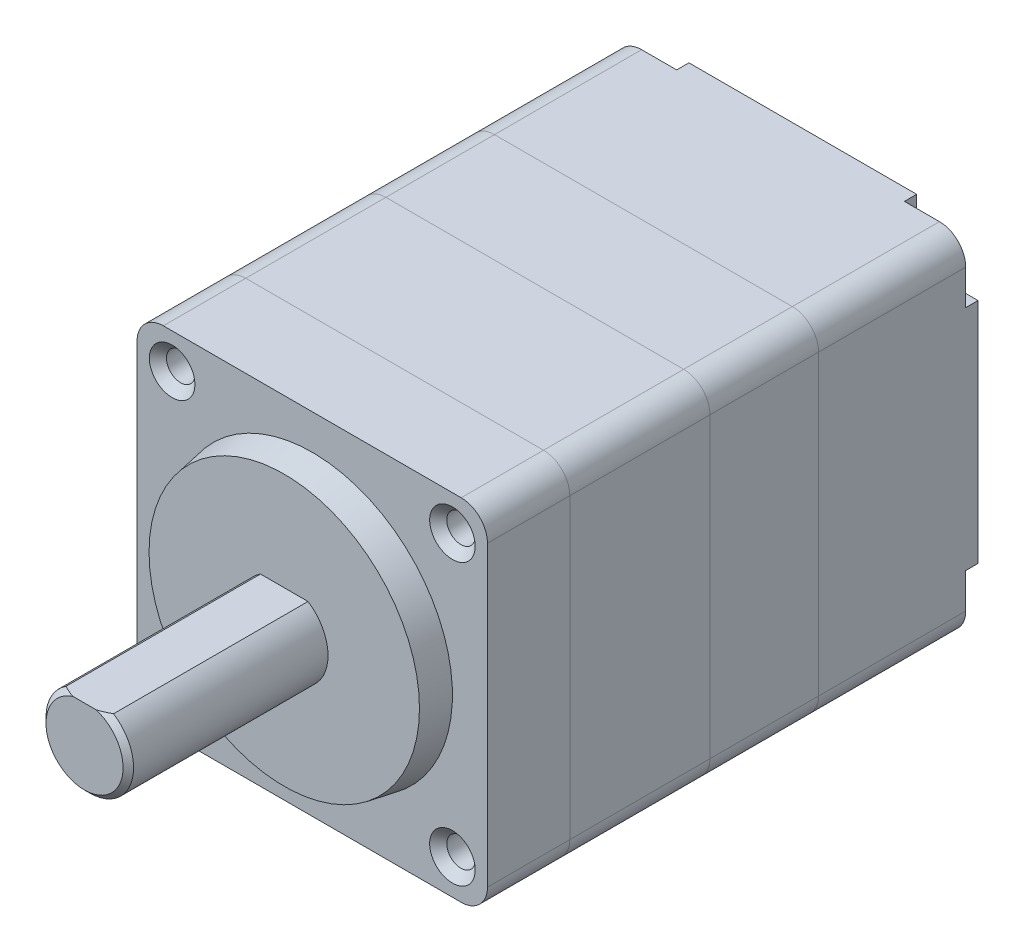
from build123d import *

# Parameters (mm, degrees)
SKETCH_1_W          = 20
SKETCH_1_H          = 20
EXTRUDE_1_DEPTH     = 9.1
CUT_EXTRUDE_1_REACH = 18.817
SKETCH_2_R          = 1
SKETCH_3_W          = 3.5
SKETCH_3_H          = 3.5
CUT_EXTRUDE_2_DEPTH = 0.7
FILLET_1_R          = 1.5
SKETCH_4_W          = 20
SKETCH_4_H          = 20
EXTRUDE_2_DEPTH     = 6.2
SKETCH_5_W          = 20
SKETCH_5_H          = 20
EXTRUDE_3_DEPTH     = 8
CUT_EXTRUDE_START   = -8
SKETCH_6_R          = 1
CUT_EXTRUDE_3_DEPTH = 8
SKETCH_7_W          = 20
SKETCH_7_H          = 20
EXTRUDE_4_DEPTH     = 4.7
SKETCH_8_R          = 0.8115
CUT_EXTRUDE_4_DEPTH = 4.7
FILLET_2_R          = 1.5
FILLET_3_R          = 1.5
FILLET_4_R          = 1.5
FILLET_5_R          = 1.5
CUT_EXTRUDE_5_DEPTH = 1.6
EXTRUDE_5_DEPTH     = 13
CHAMFER_1_SIZE      = 0.3
CHAMFER_2_SIZE      = 0.4885


with BuildPart() as part:
    # 草图1 → 凸台-拉伸1 (new body)
    with BuildSketch(Plane.XY):
        Rectangle(SKETCH_1_W, SKETCH_1_H)
    extrude(amount=EXTRUDE_1_DEPTH)

    # 草图2 → 切除-拉伸1 (cut, up to next)
    with BuildSketch(Plane(origin=(0, 0, 0), x_dir=(-1, 0, 0), z_dir=(0, 0, -1)), mode=Mode.PRIVATE) as cut_extrude_1_sk1:
        with Locations((-8, 8)):
            Circle(SKETCH_2_R)
    cut_extrude_1_tool1 = extrude(cut_extrude_1_sk1.sketch, amount=-CUT_EXTRUDE_1_REACH, mode=Mode.PRIVATE) & part.part
    # 草图2 → 切除-拉伸1 (cut, up to next)
    with BuildSketch(Plane(origin=(0, 0, 0), x_dir=(-1, 0, 0), z_dir=(0, 0, -1)), mode=Mode.PRIVATE) as cut_extrude_1_sk2:
        with Locations((8, 8)):
            Circle(SKETCH_2_R)
    cut_extrude_1_tool2 = extrude(cut_extrude_1_sk2.sketch, amount=-CUT_EXTRUDE_1_REACH, mode=Mode.PRIVATE) & part.part
    # 草图2 → 切除-拉伸1 (cut, up to next)
    with BuildSketch(Plane(origin=(0, 0, 0), x_dir=(-1, 0, 0), z_dir=(0, 0, -1)), mode=Mode.PRIVATE) as cut_extrude_1_sk3:
        with Locations((8, -8)):
            Circle(SKETCH_2_R)
    cut_extrude_1_tool3 = extrude(cut_extrude_1_sk3.sketch, amount=-CUT_EXTRUDE_1_REACH, mode=Mode.PRIVATE) & part.part
    # 草图2 → 切除-拉伸1 (cut, up to next)
    with BuildSketch(Plane(origin=(0, 0, 0), x_dir=(-1, 0, 0), z_dir=(0, 0, -1)), mode=Mode.PRIVATE) as cut_extrude_1_sk4:
        with Locations((-8, -8)):
            Circle(SKETCH_2_R)
    cut_extrude_1_tool4 = extrude(cut_extrude_1_sk4.sketch, amount=-CUT_EXTRUDE_1_REACH, mode=Mode.PRIVATE) & part.part
    add(cut_extrude_1_tool1.solids().sort_by_distance((8, 8, 0))[0], mode=Mode.SUBTRACT)
    add(cut_extrude_1_tool2.solids().sort_by_distance((-8, 8, 0))[0], mode=Mode.SUBTRACT)
    add(cut_extrude_1_tool3.solids().sort_by_distance((-8, -8, 0))[0], mode=Mode.SUBTRACT)
    add(cut_extrude_1_tool4.solids().sort_by_distance((8, -8, 0))[0], mode=Mode.SUBTRACT)

    # 草图3 → 切除-拉伸2 (cut)
    with BuildSketch(Plane(origin=(0, 0, 0), x_dir=(-1, 0, 0), z_dir=(0, 0, -1))):
        with Locations((-8.25, 8.25)):
            Rectangle(SKETCH_3_W, SKETCH_3_H)
        with Locations((8.25, 8.25)):
            Rectangle(SKETCH_3_W, SKETCH_3_H)
        with Locations((8.25, -8.25)):
            Rectangle(SKETCH_3_W, SKETCH_3_H)
        with Locations((-8.25, -8.25)):
            Rectangle(SKETCH_3_W, SKETCH_3_H)
    extrude(amount=-CUT_EXTRUDE_2_DEPTH, mode=Mode.SUBTRACT)

    # 圆角1
    fillet_1_edges = [part.edges().sort_by_distance(p)[0] for p in [
        (6.5, -6.5, 0.35),
        (-6.5, -6.5, 0.35),
        (-6.5, 6.5, 0.35),
        (6.5, 6.5, 0.35),
    ]]
    fillet(fillet_1_edges, radius=FILLET_1_R)

    # 圆角5
    fillet_5_edges = [part.edges().sort_by_distance(p)[0] for p in [
        (10, -10, 4.9),
        (-10, -10, 4.9),
        (-10, 10, 4.9),
        (10, 10, 4.9),
    ]]
    fillet(fillet_5_edges, radius=FILLET_5_R)


with BuildPart() as body_2:
    # 草图4 → 凸台-拉伸2 (new body)
    with BuildSketch(Plane.XY.offset(9.1)):
        Rectangle(SKETCH_4_W, SKETCH_4_H)
    extrude(amount=EXTRUDE_2_DEPTH)

    # 圆角4
    fillet_4_edges = [body_2.edges().sort_by_distance(p)[0] for p in [
        (-10, -10, 12.2),
        (-10, 10, 12.2),
        (10, 10, 12.2),
        (10, -10, 12.2),
    ]]
    fillet(fillet_4_edges, radius=FILLET_4_R)


with BuildPart() as body_3:
    # 草图5 → 凸台-拉伸3 (new body)
    with BuildSketch(Plane.XY.offset(15.3)):
        Rectangle(SKETCH_5_W, SKETCH_5_H)
    extrude(amount=EXTRUDE_3_DEPTH)

    # 草图6 → 切除-拉伸3 (cut)
    with BuildSketch(Plane.XY.offset(23.3).offset(CUT_EXTRUDE_START)):
        with Locations((-8, 8)):
            Circle(SKETCH_6_R)
        with Locations((8, 8)):
            Circle(SKETCH_6_R)
        with Locations((-8, -8)):
            Circle(SKETCH_6_R)
        with Locations((8, -8)):
            Circle(SKETCH_6_R)
    extrude(amount=CUT_EXTRUDE_3_DEPTH, mode=Mode.SUBTRACT)

    # 圆角3
    fillet_3_edges = [body_3.edges().sort_by_distance(p)[0] for p in [
        (-10, 10, 19.3),
        (10, 10, 19.3),
        (10, -10, 19.3),
        (-10, -10, 19.3),
    ]]
    fillet(fillet_3_edges, radius=FILLET_3_R)


with BuildPart() as body_4:
    # 草图7 → 凸台-拉伸4 (new body)
    with BuildSketch(Plane.XY.offset(23.3)):
        Rectangle(SKETCH_7_W, SKETCH_7_H)
    extrude(amount=EXTRUDE_4_DEPTH)

    # 草图8 → 切除-拉伸4 (cut)
    with BuildSketch(Plane.XY.offset(28)):
        with Locations((-8, 8)):
            Circle(SKETCH_8_R)
        with Locations((8, 8)):
            Circle(SKETCH_8_R)
        with Locations((8, -8)):
            Circle(SKETCH_8_R)
        with Locations((-8, -8)):
            Circle(SKETCH_8_R)
    extrude(amount=-CUT_EXTRUDE_4_DEPTH, mode=Mode.SUBTRACT)

    # 圆角2
    fillet_2_edges = [body_4.edges().sort_by_distance(p)[0] for p in [
        (10, 10, 25.65),
        (10, -10, 25.65),
        (-10, -10, 25.65),
        (-10, 10, 25.65),
    ]]
    fillet(fillet_2_edges, radius=FILLET_2_R)

    # 倒角2
    chamfer_2_edges = [body_4.edges().sort_by_distance(p)[0] for p in [
        (-8.8115, -8, 28),
        (7.1885, -8, 28),
        (7.1885, 8, 28),
        (-8.8115, 8, 28),
    ]]
    chamfer(chamfer_2_edges, length=CHAMFER_2_SIZE)


with BuildPart() as body_5:
    # 草图9 → 旋转1 (revolve)
    with BuildSketch(Plane(origin=(0, 0, 0), x_dir=(0, 0, -1), z_dir=(1, 0, 0)), mode=Mode.PRIVATE) as revolve_1_sk:
        Polygon((-28, 0), (-28, 8), (-29.6, 7.718), (-29.6, 0), align=None)
    revolve(revolve_1_sk.sketch.rotate(Axis((0, 0, 0), (0, 0, 1)), 90), axis=Axis((0, 0, 0), (0, 0, 1)))

    # 草图10 → 切除-拉伸5 (cut)
    with BuildSketch(Plane.XY.offset(29.6)):
        with BuildLine():
            Line((-1.356465997, 2.1), (1.356465997, 2.1))
            ThreePointArc((1.356465997, 2.1), (0, -2.5), (-1.356465997, 2.1))
        make_face()
    extrude(amount=-CUT_EXTRUDE_5_DEPTH, mode=Mode.SUBTRACT)


with BuildPart() as body_6:
    # 草图11 → 凸台-拉伸5 (new body)
    with BuildSketch(Plane.XY.offset(28)):
        with BuildLine():
            Line((1.356465997, 2.1), (-1.356465997, 2.1))
            ThreePointArc((-1.356465997, 2.1), (0, -2.5), (1.356465997, 2.1))
        make_face()
    extrude(amount=EXTRUDE_5_DEPTH)

    # 倒角1
    chamfer_1_edges = [body_6.edges().sort_by_distance(p)[0] for p in [
        (0, -2.5, 41),
    ]]
    chamfer(chamfer_1_edges, length=CHAMFER_1_SIZE)


solid = Compound([part.part, body_2.part, body_3.part, body_4.part, body_5.part, body_6.part])
